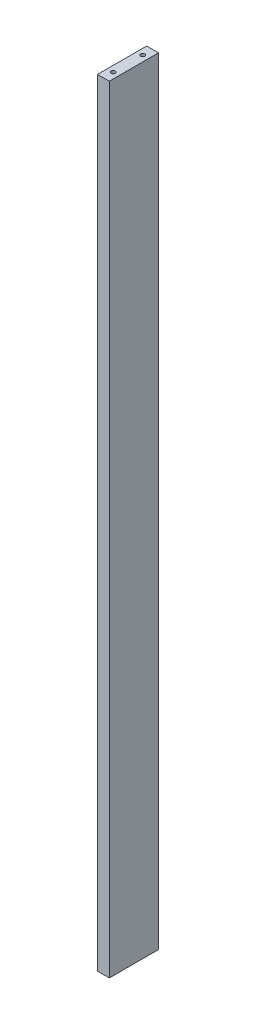
from build123d import *

# Parameters (mm, degrees)
SKETCH1_W                             = 12
SKETCH1_H                             = 50
BASE_DEPTH                            = 789.8
END_BOLT_HOLES_FOR_INSERTS_AT_2_COUNT = 2
END_BOLT_HOLES_FOR_INSERTS_AT_2_PITCH = 30


with BuildPart() as part:
    # Sketch1 → base (new body)
    with BuildSketch(Plane(origin=(0, 0, 0), x_dir=(1, 0, 0), z_dir=(0, 1, 0))):
        with Locations((6, 25)):
            Rectangle(SKETCH1_W, SKETCH1_H)
    extrude(amount=BASE_DEPTH)

    # Sketch3 → end bolt holes for inserts (revolve, cut)
    with BuildSketch(Plane(origin=(6, 0, -40), x_dir=(0, 0, -1), z_dir=(1, 0, 0))):
        Polygon((0, 0), (0, 15.2618073), (2.1, 14), (2.1, 0), align=None)
    end_bolt_holes_for_inserts = revolve(axis=Axis((6, -6.35, -40), (0, 1, 0)), mode=Mode.SUBTRACT)

    # end bolt holes for inserts at 2: end bolt holes for inserts ×2
    with Locations(*[(0, 0, i * END_BOLT_HOLES_FOR_INSERTS_AT_2_PITCH) for i in range(1, END_BOLT_HOLES_FOR_INSERTS_AT_2_COUNT)]):
        add(end_bolt_holes_for_inserts, mode=Mode.SUBTRACT)

    # mirror end bolt holes: end bolt holes for inserts across plane
    add(end_bolt_holes_for_inserts.mirror(Plane(origin=(0, 394.9, 0), x_dir=(0, 0, 1), z_dir=(0, -1, 0))), mode=Mode.SUBTRACT)

    # mirror end bolt holes copy 1 sketch → mirror end bolt holes copy 1 (revolve, cut)
    with BuildSketch(Plane(origin=(6, 789.8, -10), x_dir=(0, 0, -1), z_dir=(1, 0, 0))):
        Polygon((0, 0), (0, -15.2618073), (2.1, -14), (2.1, 0), align=None)
    revolve(axis=Axis((6, 796.15, -10), (0, 1, 0)), mode=Mode.SUBTRACT)


solid = part.part
